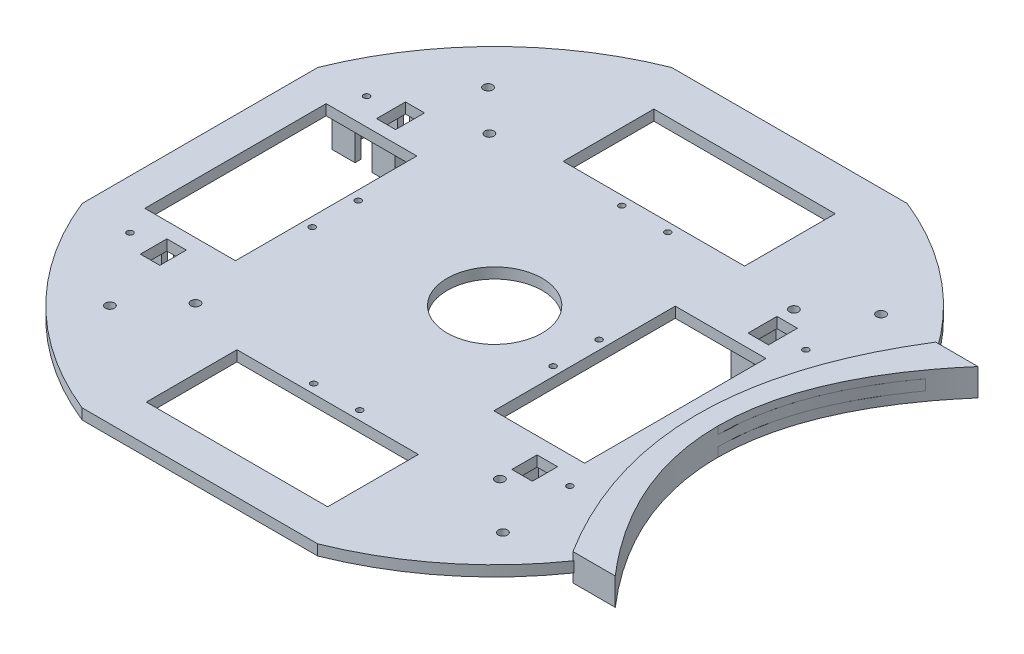
from build123d import *

# Parameters (mm, degrees)
SKETCH1_W                = 195
SKETCH1_H                = 195
BOSS_EXTRUDE3_DEPTH      = 3.5
SKETCH2_R                = 177.836364648
SKETCH2_R_2              = 105
CUT_EXTRUDE2_DEPTH       = 30
SKETCH4_W                = 30
SKETCH4_H                = 60
SKETCH4_W_2              = 60
SKETCH4_H_2              = 30
CUT_EXTRUDE7_DEPTH       = 5
BOSS_EXTRUDE5_DEPTH      = 6
BOSS_EXTRUDE5_DEPTH_BACK = 3
CUT_EXTRUDE12_DEPTH      = 6
CUT_EXTRUDE12_DEPTH_BACK = 6
SKETCH13_R               = 1.5
SKETCH13_R_2             = 15.721905528
TOP_TO_MID_STAND_DEPTH   = 6
SKETCH14_R               = 1.5
MIT_TO_BOT_STAND_DEPTH   = 6
SKETCH15_R               = 1
CUT_EXTRUDE13_DEPTH      = 10
SKETCH20_R               = 1
SKETCH20_W               = 6.440350206
SKETCH20_H               = 8.769221321
CUT_EXTRUDE14_DEPTH      = 10
SKETCH22_R               = 1
SKETCH22_W               = 6.307030748
SKETCH22_H               = 9.566844392
SKETCH22_W_2             = 6.77752461
SKETCH22_H_2             = 8.344689789
CUT_EXTRUDE15_DEPTH      = 10
BOSS_EXTRUDE6_DEPTH      = 10
BOSS_EXTRUDE7_DEPTH      = 10
BOSS_EXTRUDE8_DEPTH      = 10
BOSS_EXTRUDE9_DEPTH      = 10
BOSS_EXTRUDE10_DEPTH     = 10


with BuildPart() as part:
    # Sketch1 → Boss-Extrude3 (new body)
    with BuildSketch(Plane(origin=(0, 0, 0), x_dir=(1, 0, 0), z_dir=(0, 1, 0))):
        Rectangle(SKETCH1_W, SKETCH1_H)
    extrude(amount=BOSS_EXTRUDE3_DEPTH)

    # Sketch2 → Cut-Extrude2 (cut)
    with BuildSketch(Plane(origin=(0, 0, 0), x_dir=(1, 0, 0), z_dir=(0, 1, 0))):
        Circle(SKETCH2_R)
        Circle(SKETCH2_R_2, mode=Mode.SUBTRACT)
    extrude(amount=CUT_EXTRUDE2_DEPTH, mode=Mode.SUBTRACT)

    # Sketch4 → Cut-Extrude7 (cut)
    with BuildSketch(Plane(origin=(0, 0, 0), x_dir=(1, 0, 0), z_dir=(0, 1, 0))):
        with Locations((45, -0.259206865)):
            Rectangle(SKETCH4_W, SKETCH4_H)
        with Locations((0, 67.669311598)):
            Rectangle(SKETCH4_W_2, SKETCH4_H_2)
        with Locations((-70.744213578, 0)):
            Rectangle(SKETCH4_W, SKETCH4_H)
        with Locations((0, -70.245377815)):
            Rectangle(SKETCH4_W_2, SKETCH4_H_2)
    extrude(amount=CUT_EXTRUDE7_DEPTH, mode=Mode.SUBTRACT)

    # Sketch6 → Boss-Extrude5 (add, two sides: drawn at the far end of the back side and taken through both)
    with BuildSketch(Plane(origin=(0, 0, 0), x_dir=(1, 0, 0), z_dir=(0, 1, 0)).offset(-BOSS_EXTRUDE5_DEPTH_BACK)):
        with BuildLine():
            Line((99.887770318, 60), (85.887770318, 60))
            add(Edge.make_bspline(
                [(85.887770318, 60), (48.439587705, 0), (85.887770318, -60)],
                knots=[0, 0, 0, 1, 1, 1], degree=2))
            Line((85.887770318, -60), (99.887770318, -60))
            add(Edge.make_bspline(
                [(99.887770318, 60), (47.863555335, 0), (99.887770318, -60)],
                knots=[0, 0, 0, 1, 1, 1], degree=2))
        make_face()
    extrude(amount=BOSS_EXTRUDE5_DEPTH + BOSS_EXTRUDE5_DEPTH_BACK)

    # Sketch11 → Cut-Extrude12 (cut, two sides: drawn at the far end of the back side and taken through both)
    with BuildSketch(Plane(origin=(0, 0, 0), x_dir=(1, 0, 0), z_dir=(0, 1, 0)).offset(-CUT_EXTRUDE12_DEPTH_BACK)):
        with BuildLine():
            Line((99.887770318, -60), (114.577459752, -60))
            Line((114.577459752, -60), (112.469175223, 59.986841606))
            Line((112.469175223, 59.986841606), (99.887770318, 59.986841606))
            add(Edge.make_bspline(
                [(99.887770318, 59.986841606), (47.863554892, -0.004496949), (99.887770318, -60)],
                knots=[0, 0, 0, 1, 1, 1], degree=2))
        make_face()
    extrude(amount=CUT_EXTRUDE12_DEPTH + CUT_EXTRUDE12_DEPTH_BACK, mode=Mode.SUBTRACT)

    # Sketch13 → top to mid stand (cut)
    with BuildSketch(Plane(origin=(0, 0, 0), x_dir=(1, 0, 0), z_dir=(0, 1, 0))):
        with Locations((-63.643035227, 61.463814798)):
            Circle(SKETCH13_R)
        with Locations((66.356964773, 61.463814798)):
            Circle(SKETCH13_R)
        with Locations((66.356964773, -63.636185202)):
            Circle(SKETCH13_R)
        with Locations((-63.643035227, -63.636185202)):
            Circle(SKETCH13_R)
        Circle(SKETCH13_R_2)
    extrude(amount=TOP_TO_MID_STAND_DEPTH, mode=Mode.SUBTRACT)

    # Sketch14 → mit to bot stand (cut)
    with BuildSketch(Plane(origin=(0, 0, 0), x_dir=(1, 0, 0), z_dir=(0, 1, 0))):
        with Locations((-50.173994207, 48.41640264)):
            Circle(SKETCH14_R)
        with Locations((50.556931854, 48.41640264)):
            Circle(SKETCH14_R)
        with Locations((50.556931854, -48.811579623)):
            Circle(SKETCH14_R)
        with Locations((-50.173994207, -48.811579623)):
            Circle(SKETCH14_R)
    extrude(amount=MIT_TO_BOT_STAND_DEPTH, mode=Mode.SUBTRACT)

    # Sketch15 → Cut-Extrude13 (cut)
    with BuildSketch(Plane(origin=(0, 0, 0), x_dir=(1, 0, 0), z_dir=(0, 1, 0))):
        with Locations((-52.671644248, 7.524325875)):
            Circle(SKETCH15_R)
        with Locations((-52.671644248, -7.675674125)):
            Circle(SKETCH15_R)
        with Locations((27, 7.524325875)):
            Circle(SKETCH15_R)
        with Locations((27, -7.675674125)):
            Circle(SKETCH15_R)
        with Locations((-7.6, 49.669311598)):
            Circle(SKETCH15_R)
        with Locations((7.6, 49.669311598)):
            Circle(SKETCH15_R)
        with Locations((-7.6, -52.245377815)):
            Circle(SKETCH15_R)
        with Locations((7.6, -52.245377815)):
            Circle(SKETCH15_R)
    extrude(amount=CUT_EXTRUDE13_DEPTH, mode=Mode.SUBTRACT)

    # Sketch20 → Cut-Extrude14 (cut)
    with BuildSketch(Plane(origin=(0, 0, 0), x_dir=(1, 0, 0), z_dir=(0, 1, 0))):
        with Locations((-81.19940982, -39.454793411)):
            Circle(SKETCH20_R)
        with Locations((-70.142182056, -39.454793411)):
            Rectangle(SKETCH20_W, SKETCH20_H)
    extrude(amount=CUT_EXTRUDE14_DEPTH, mode=Mode.SUBTRACT)

    # Sketch22 → Cut-Extrude15 (cut)
    with BuildSketch(Plane(origin=(0, 0, 0), x_dir=(1, 0, 0), z_dir=(0, 1, 0))):
        with Locations((-81.19940982, 38.826296832)):
            Circle(SKETCH22_R)
        with Locations((64.107992091, 38.826296832)):
            Circle(SKETCH22_R)
        with Locations((64.107992091, -39.222277976)):
            Circle(SKETCH22_R)
        with Locations((-69.971805973, 38.826296832)):
            Rectangle(SKETCH22_W, SKETCH22_H)
        with Locations((53.153620918, 38.826296832)):
            Rectangle(SKETCH22_W_2, SKETCH22_H)
        with Locations((53.153620918, -39.905025323)):
            Rectangle(SKETCH22_W_2, SKETCH22_H_2)
    extrude(amount=CUT_EXTRUDE15_DEPTH, mode=Mode.SUBTRACT)

    # Sketch16 → Boss-Extrude6 (add)
    with BuildSketch(Plane(origin=(0, 0, 0), x_dir=(1, 0, 0), z_dir=(0, 1, 0))):
        Polygon((-76.46412126, 46.254439747), (-85.128182405, 46.254439747), (-85.128182405, 31.33633149), (-77.531013871, 31.33633149), (-77.531013871, 33.33633149), (-83.231013871, 33.33633149), (-83.231013871, 44.254439747), (-76.46412126, 44.254439747), align=None)
        Polygon((-66.249877555, 33.354439747), (-71.949877555, 33.354439747), (-71.949877555, 31.354439747), (-64.349877555, 31.354439747), (-64.349877555, 46.254439747), (-72.403611083, 46.254439747), (-72.403611083, 44.254439747), (-66.249877555, 44.254439747), align=None)
    extrude(amount=-BOSS_EXTRUDE6_DEPTH)

    # Sketch18 → Boss-Extrude7 (add)
    with BuildSketch(Plane(origin=(0, 0, 0), x_dir=(1, 0, 0), z_dir=(0, 1, 0))):
        Polygon((46.863276854, 46.233630075), (46.863276854, 31.315521817), (54.460445388, 31.315521817), (54.460445388, 33.315521817), (48.760445388, 33.315521817), (48.760445388, 44.233630075), (55.497974493, 44.233630075), (55.497974493, 46.233630075), align=None)
    extrude(amount=-BOSS_EXTRUDE7_DEPTH)

    # Sketch18<3> → Boss-Extrude8 (add)
    with BuildSketch(Plane(origin=(0, 0, 0), x_dir=(1, 0, 0), z_dir=(0, 1, 0))):
        Polygon((46.863276854, 46.233630075), (46.863276854, 31.315521817), (54.460445388, 31.315521817), (54.460445388, 33.315521817), (48.760445388, 33.315521817), (48.760445388, 44.233630075), (55.497974493, 44.233630075), (55.497974493, 46.233630075), align=None)
        Polygon((60.520368887, 33.333630075), (60.520368887, 31.333630075), (68.120368887, 31.333630075), (68.120368887, 46.233630075), (59.937098057, 46.233630075), (59.937098057, 44.233630075), (66.220368887, 44.233630075), (66.220368887, 33.333630075), align=None)
    extrude(amount=-BOSS_EXTRUDE8_DEPTH)

    # Sketch17 → Boss-Extrude9 (add)
    with BuildSketch(Plane(origin=(0, 0, 0), x_dir=(1, 0, 0), z_dir=(0, 1, 0))):
        Polygon((46.863276854, -32.192703299), (46.863276854, -47.110811557), (54.460445388, -47.110811557), (54.460445388, -45.110811557), (48.760445388, -45.110811557), (48.760445388, -34.192703299), (55.497974493, -34.192703299), (55.497974493, -32.192703299), align=None)
        Polygon((60.520368887, -45.092703299), (60.520368887, -47.092703299), (68.120368887, -47.092703299), (68.120368887, -32.192703299), (59.937098057, -32.192703299), (59.937098057, -34.192703299), (66.220368887, -34.192703299), (66.220368887, -45.092703299), align=None)
    extrude(amount=-BOSS_EXTRUDE9_DEPTH)

    # Sketch23 → Boss-Extrude10 (add)
    with BuildSketch(Plane(origin=(0, 0, 0), x_dir=(1, 0, 0), z_dir=(0, 1, 0))):
        Polygon((-76.46412126, -31.768734247), (-85.128182405, -31.768734247), (-85.128182405, -46.686842504), (-77.531013871, -46.686842504), (-77.531013871, -44.686842504), (-83.231013871, -44.686842504), (-83.231013871, -33.768734247), (-76.46412126, -33.768734247), align=None)
        Polygon((-66.249877555, -44.668734247), (-71.949877555, -44.668734247), (-71.949877555, -46.668734247), (-64.349877555, -46.668734247), (-64.349877555, -31.768734247), (-72.403611083, -31.768734247), (-72.403611083, -33.768734247), (-66.249877555, -33.768734247), align=None)
    extrude(amount=-BOSS_EXTRUDE10_DEPTH)


solid = part.part
